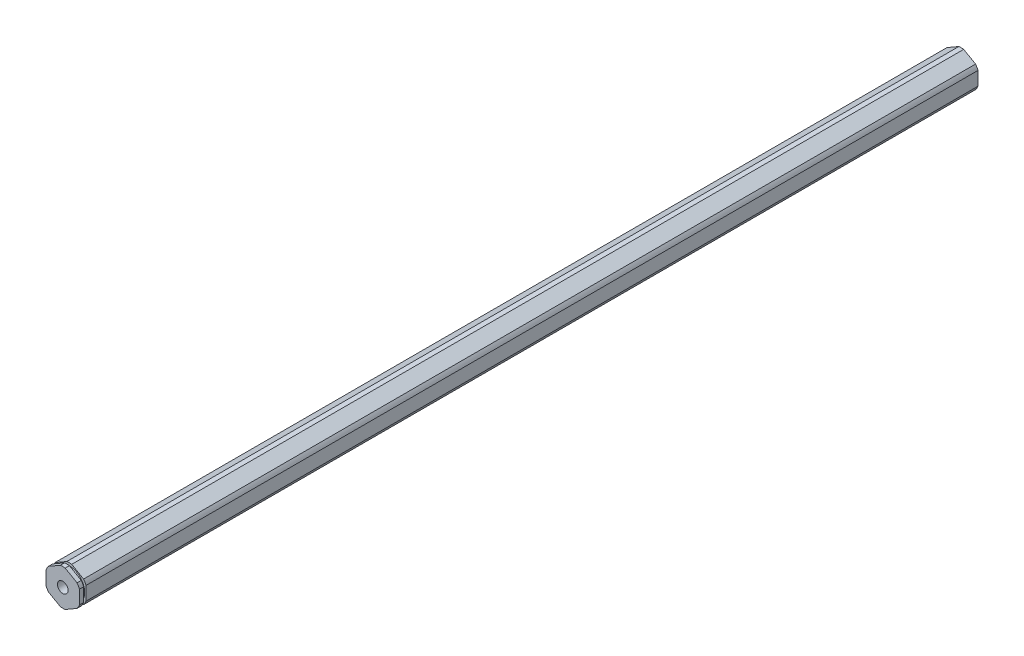
from build123d import *

# Parameters (mm, degrees)
BOSS_EXTRUDE1_DEPTH                  = 170.307
F_10_32_TAPPED_HOLE1_D               = 4.0386
F_10_32_TAPPED_HOLE1_DEPTH           = 16.34744
F_10_32_TAPPED_HOLE1_TIP             = 1.213317848
F_10_32_TAPPED_HOLE1_ON_FACE_2_D     = 4.0386
F_10_32_TAPPED_HOLE1_ON_FACE_2_DEPTH = 16.34744
F_10_32_TAPPED_HOLE1_ON_FACE_2_TIP   = 1.213317848
SKETCH5_W                            = 0.889
SKETCH5_H                            = 1.0033


with BuildPart() as part:
    # Sketch1 → Boss-Extrude1 (new, symmetric)
    with BuildSketch(Plane.XY):
        with BuildLine():
            ThreePointArc((0.93173274, 6.79441227), (0, 6.858), (-0.93173274, 6.79441227))
            Line((-0.93173274, 6.79441227), (-5.41826726, 4.204110358))
            ThreePointArc((-5.41826726, 4.204110358), (-5.939202219, 3.429), (-6.35, 2.590301913))
            Line((-6.35, 2.590301913), (-6.35, -2.590301913))
            ThreePointArc((-6.35, -2.590301913), (-5.939202219, -3.429), (-5.41826726, -4.204110358))
            Line((-5.41826726, -4.204110358), (-0.93173274, -6.79441227))
            ThreePointArc((-0.93173274, -6.79441227), (0, -6.858), (0.93173274, -6.79441227))
            Line((0.93173274, -6.79441227), (5.41826726, -4.204110358))
            ThreePointArc((5.41826726, -4.204110358), (5.939202219, -3.429), (6.35, -2.590301913))
            Line((6.35, -2.590301913), (6.35, 2.590301913))
            ThreePointArc((6.35, 2.590301913), (5.939202219, 3.429), (5.41826726, 4.204110358))
            Line((5.41826726, 4.204110358), (0.93173274, 6.79441227))
        make_face()
    extrude(amount=BOSS_EXTRUDE1_DEPTH, both=True)

    # #10-32 Tapped Hole1
    with Locations(Plane.XY.offset(170.307)):
        with Locations((0, 0)):
            Hole(F_10_32_TAPPED_HOLE1_D / 2, depth=F_10_32_TAPPED_HOLE1_DEPTH)
            with Locations((0, 0, -(F_10_32_TAPPED_HOLE1_DEPTH + F_10_32_TAPPED_HOLE1_TIP / 2))):  # 118° drill point
                Cone(0, F_10_32_TAPPED_HOLE1_D / 2, F_10_32_TAPPED_HOLE1_TIP, mode=Mode.SUBTRACT)

    # #10-32 Tapped Hole1 on face 2
    with Locations(Plane(origin=(0, 0, -170.307), x_dir=(-1, 0, 0), z_dir=(0, 0, -1))):
        with Locations((0, 0)):
            Hole(F_10_32_TAPPED_HOLE1_ON_FACE_2_D / 2, depth=F_10_32_TAPPED_HOLE1_ON_FACE_2_DEPTH)
            with Locations((0, 0, -(F_10_32_TAPPED_HOLE1_ON_FACE_2_DEPTH + F_10_32_TAPPED_HOLE1_ON_FACE_2_TIP / 2))):  # 118° drill point
                Cone(0, F_10_32_TAPPED_HOLE1_ON_FACE_2_D / 2, F_10_32_TAPPED_HOLE1_ON_FACE_2_TIP, mode=Mode.SUBTRACT)

    # Sketch5 → Cut-Revolve1 (revolve, cut)
    with BuildSketch(Plane(origin=(0, 0, 0), x_dir=(0, 0, -1), z_dir=(1, 0, 0)), mode=Mode.PRIVATE) as cut_revolve1_sk:
        with Locations((-168.275, 6.35635)):
            Rectangle(SKETCH5_W, SKETCH5_H)
    revolve(cut_revolve1_sk.sketch.rotate(Axis((0, 0, 165.047176272), (0, 0, -1)), 90), axis=Axis((0, 0, 165.047176272), (0, 0, -1)), mode=Mode.SUBTRACT)


solid = part.part
